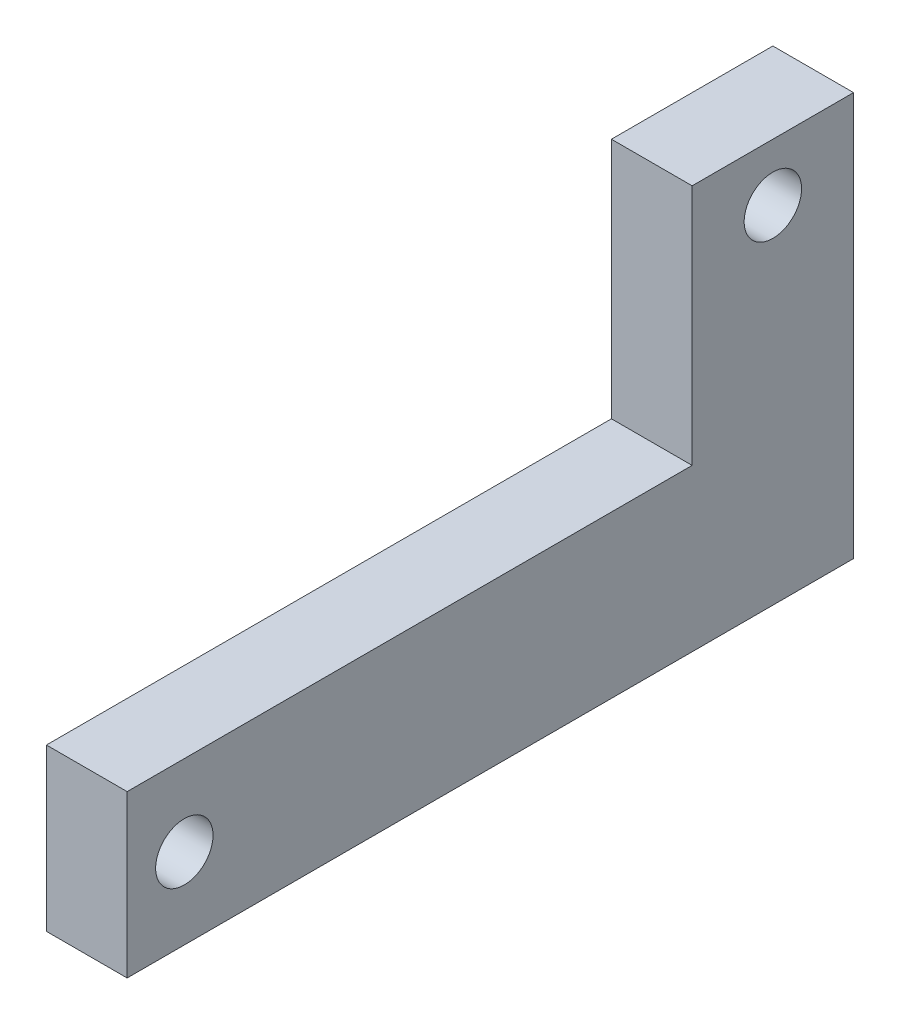
from build123d import *

# Parameters (mm, degrees)
BOSS_EXTRUDE1_DEPTH          = 5
F_5_32_0_14_DIAMETER_HOLE1_D = 3.556


with BuildPart() as part:
    # Sketch1 → Boss-Extrude1 (new body)
    with BuildSketch(Plane(origin=(0, 0, 0), x_dir=(0, 0, -1), z_dir=(1, 0, 0))):
        Polygon((-40, -2.5), (-5, -2.5), (-5, 12.5), (5, 12.5), (5, -2.5), (5, -12.5), (-40, -12.5), align=None)
    extrude(amount=BOSS_EXTRUDE1_DEPTH)

    # 5/32 (0.14) Diameter Hole1 (through all)
    with Locations(Plane(origin=(5, 0, 0), x_dir=(0, 0, -1), z_dir=(1, 0, 0))):
        with Locations((0, 8.957513111), (-36.457513111, -7.5)):
            Hole(F_5_32_0_14_DIAMETER_HOLE1_D / 2)


solid = part.part
